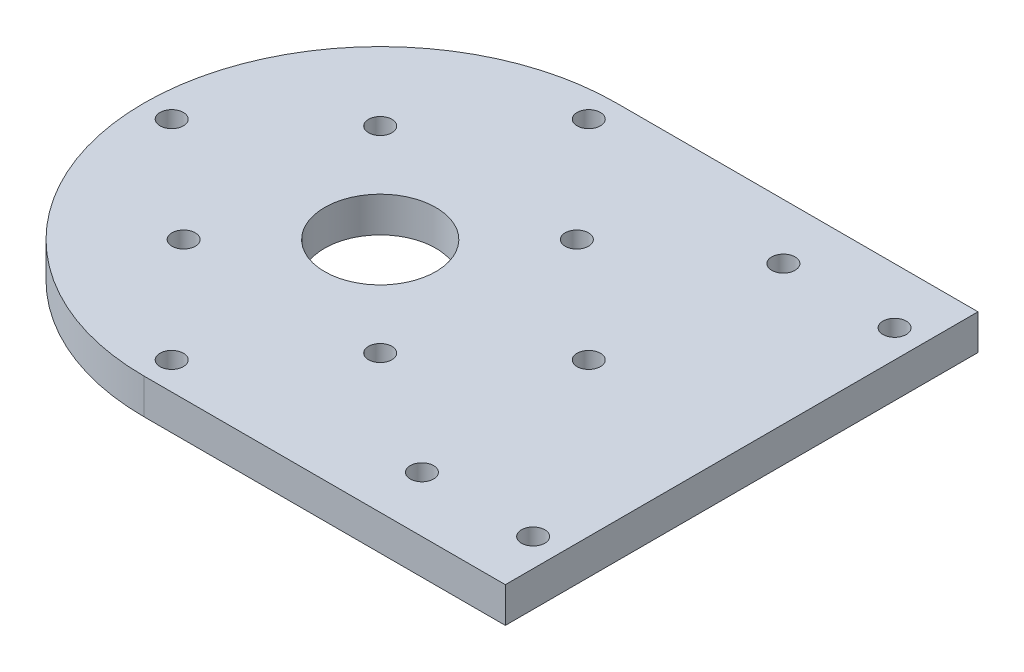
from build123d import *

# Parameters (mm, degrees)
SKETCH1_R           = 2.1
SKETCH1_R_2         = 10
BOSS_EXTRUDE1_DEPTH = 6.35


with BuildPart() as part:
    # Sketch1 → Boss-Extrude1 (new body)
    with BuildSketch(Plane(origin=(0, 0, 0), x_dir=(1, 0, 0), z_dir=(0, 1, 0))):
        with BuildLine():
            Line((65, 42.5), (0, 42.5))
            ThreePointArc((0, 42.5), (-42.5, 0), (0, -42.5))
            Line((0, -42.5), (65, -42.5))
            Line((65, -42.5), (65, 42.5))
        make_face()
        with Locations(Location((40, -32.5, 0), (0, 0, 270))):
            Circle(SKETCH1_R, mode=Mode.SUBTRACT)
        with Locations(Location((60, -32.5, 0), (0, 0, 270))):
            Circle(SKETCH1_R, mode=Mode.SUBTRACT)
        with Locations(Location((40, 32.5, 0), (0, 0, 270))):
            Circle(SKETCH1_R, mode=Mode.SUBTRACT)
        with Locations(Location((60, 32.5, 0), (0, 0, 270))):
            Circle(SKETCH1_R, mode=Mode.SUBTRACT)
        with Locations(Location((37.5, 0, 0), (0, 0, 270))):
            Circle(SKETCH1_R, mode=Mode.SUBTRACT)
        with Locations(Location((17.67766953, 17.67766953, 0), (0, 0, 270))):
            Circle(SKETCH1_R, mode=Mode.SUBTRACT)
        with Locations(Location((0, -37.5, 0), (0, 0, 270))):
            Circle(SKETCH1_R, mode=Mode.SUBTRACT)
        with Locations(Location((-17.67766953, -17.67766953, 0), (0, 0, 270))):
            Circle(SKETCH1_R, mode=Mode.SUBTRACT)
        with Locations(Location((17.67766953, -17.67766953, 0), (0, 0, 270))):
            Circle(SKETCH1_R, mode=Mode.SUBTRACT)
        with Locations(Location((-37.5, 0, 0), (0, 0, 270))):
            Circle(SKETCH1_R, mode=Mode.SUBTRACT)
        with Locations(Location((-17.67766953, 17.67766953, 0), (0, 0, 270))):
            Circle(SKETCH1_R, mode=Mode.SUBTRACT)
        with Locations(Location((0, 0, 0), (0, 0, 270))):
            Circle(SKETCH1_R_2, mode=Mode.SUBTRACT)
        with Locations(Location((0, 37.5, 0), (0, 0, 270))):
            Circle(SKETCH1_R, mode=Mode.SUBTRACT)
    extrude(amount=-BOSS_EXTRUDE1_DEPTH)


solid = part.part
